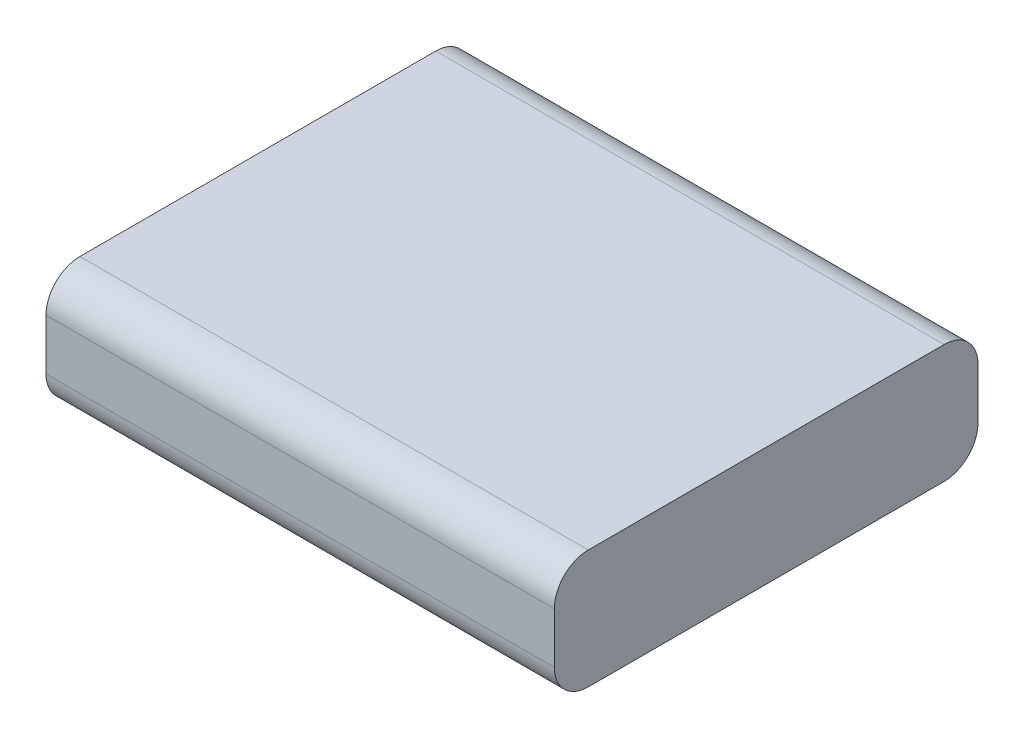
from build123d import *

# Parameters (mm, degrees)
SKETCH_1_W      = 30
SKETCH_1_H      = 25
EXTRUDE_1_DEPTH = 7
FILLET_1_R      = 2


with BuildPart() as part:
    # Эскиз1 → Бобышка-Вытянуть1 (new body)
    with BuildSketch(Plane(origin=(0, 0, 0), x_dir=(1, 0, 0), z_dir=(0, 1, 0))):
        Rectangle(SKETCH_1_W, SKETCH_1_H)
    extrude(amount=EXTRUDE_1_DEPTH)

    # Скругление1
    fillet_1_edges = [part.edges().sort_by_distance(p)[0] for p in [
        (0, 7, 12.5),
        (0, 0, 12.5),
        (0, 0, -12.5),
        (0, 7, -12.5),
    ]]
    fillet(fillet_1_edges, radius=FILLET_1_R)


solid = part.part
